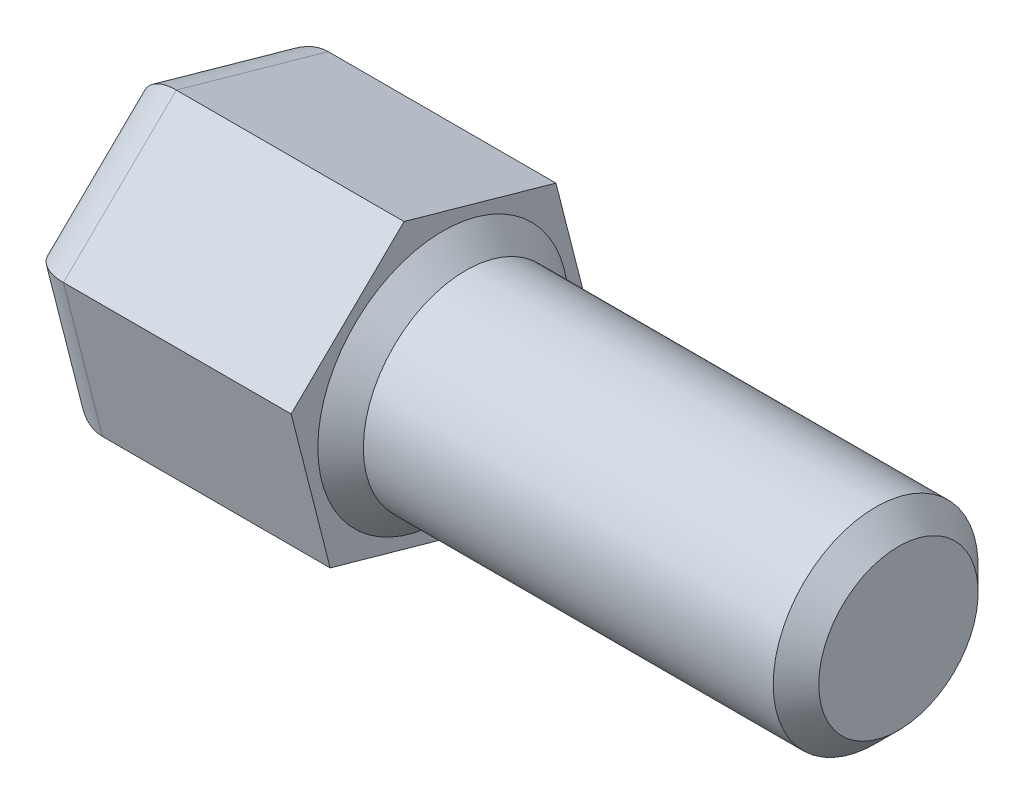
from build123d import *

# Parameters (mm, degrees)
SKETCH_1_W      = 20
SKETCH_1_H      = 4.5
EXTRUDE_1_DEPTH = 12
FILLET_1_R      = 2
CHAMFER_1_SIZE  = 1


with BuildPart() as part:
    # 草圖1 → 旋轉1 (revolve)
    with BuildSketch(Plane.XY, mode=Mode.PRIVATE) as revolve_1_sk:
        with Locations((10, 2.25)):
            Rectangle(SKETCH_1_W, SKETCH_1_H)
    revolve(revolve_1_sk.sketch.rotate(Axis((0, 0, 0), (1, 0, 0)), 90), axis=Axis((0, 0, 0), (1, 0, 0)))

    # 草圖2 → 填料-伸長1 (add)
    with BuildSketch(Plane.ZY):
        Polygon((1.712942348, 6.713108707), (-4.957251505, 4.840005942), (-6.670193853, -1.873102765), (-1.712942348, -6.713108707), (4.957251505, -4.840005942), (6.670193853, 1.873102765), align=None)
    extrude(amount=EXTRUDE_1_DEPTH)

    # 圓角1
    fillet_1_edges = [part.edges().sort_by_distance(p)[0] for p in [
        (-12, 4.293105736, 4.1915681),
        (-12, 5.776557325, -1.622154578),
        (-12, 1.483451589, -5.813722679),
        (-12, -4.293105736, -4.1915681),
        (-12, -5.776557325, 1.622154578),
        (-12, -1.483451589, 5.813722679),
    ]]
    fillet(fillet_1_edges, radius=FILLET_1_R)

    # 導角1
    chamfer_1_edges = [part.edges().sort_by_distance(p)[0] for p in [
        (20, 0, -4.5),
        (0, 0, -4.5),
    ]]
    chamfer(chamfer_1_edges, length=CHAMFER_1_SIZE)


solid = part.part
